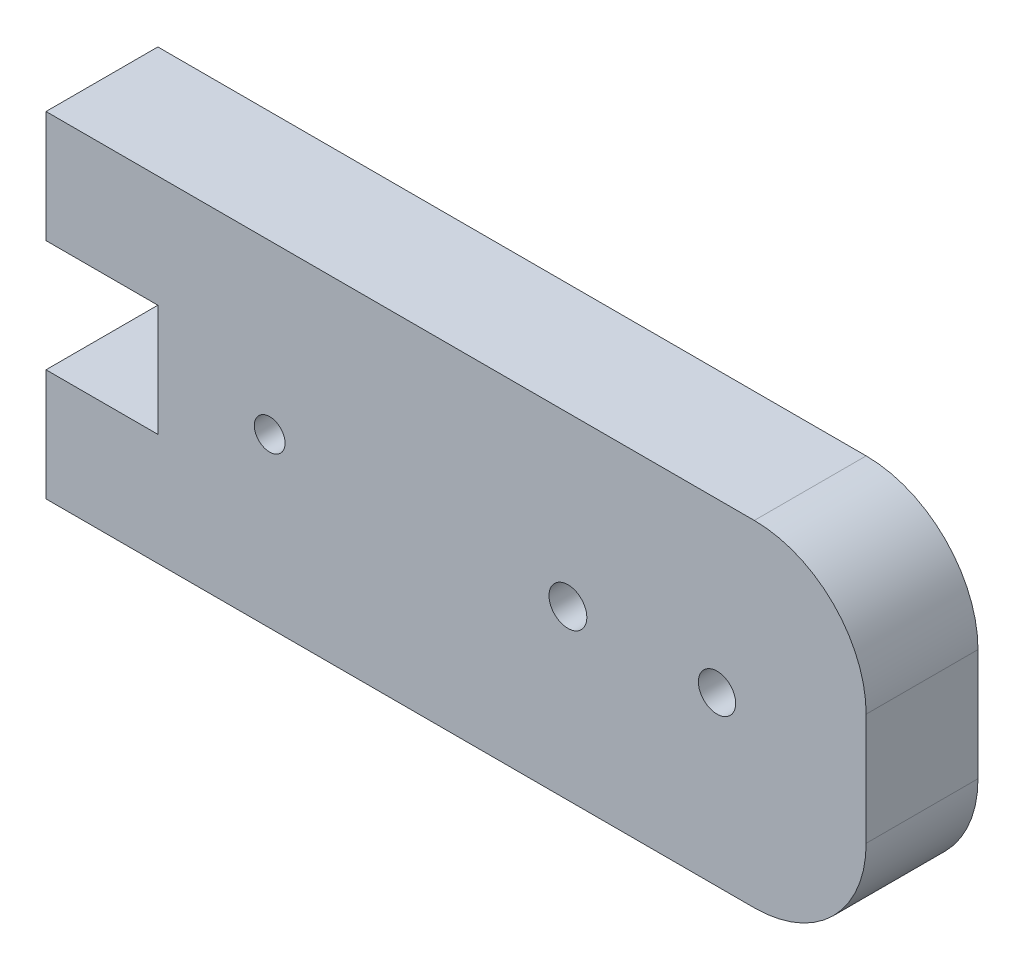
from build123d import *

# Parameters (mm, degrees)
SKETCH2_R           = 0.5
SKETCH2_R_2         = 0.507316736
SKETCH2_R_3         = 0.412242995
BOSS_EXTRUDE1_DEPTH = 3
FILLET1_R           = 3


with BuildPart() as part:
    # Sketch2 → Boss-Extrude1 (new body)
    with BuildSketch(Plane.XY):
        Polygon((-11, 4.5), (11, 4.5), (11, 0.5), (11, -0.5), (11, -4.5), (-11, -4.5), (-11, -1.5), (-8, -1.5), (-8, 1.5), (-11, 1.5), align=None)
        with Locations((7, 0)):
            Circle(SKETCH2_R, mode=Mode.SUBTRACT)
        with Locations((3, 0)):
            Circle(SKETCH2_R_2, mode=Mode.SUBTRACT)
        with Locations((-5, 0)):
            Circle(SKETCH2_R_3, mode=Mode.SUBTRACT)
    extrude(amount=BOSS_EXTRUDE1_DEPTH)

    # Fillet1
    fillet1_edges = [part.edges().sort_by_distance(p)[0] for p in [
        (11, -4.5, 1.5),
        (11, 4.5, 1.5),
    ]]
    fillet(fillet1_edges, radius=FILLET1_R)


solid = part.part
